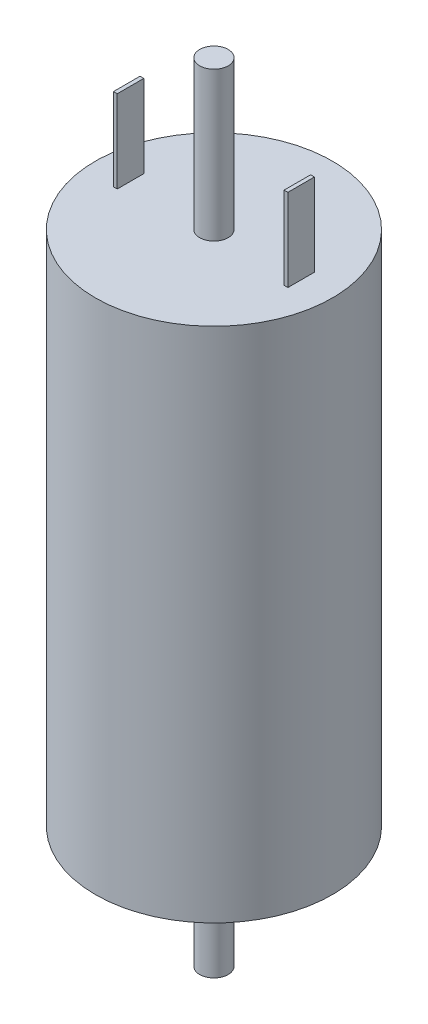
from build123d import *

# Parameters (mm, degrees)
SKETCH1_R           = 12.5
BOSS_EXTRUDE1_DEPTH = 54.5
SKETCH2_R           = 1.5
BOSS_EXTRUDE2_DEPTH = 12.8
BOSS_EXTRUDE3_START = 15.7
SKETCH3_R           = 1.5
BOSS_EXTRUDE3_DEPTH = 15.7
SKETCH4_W           = 0.4
SKETCH4_H           = 2.8
BOSS_EXTRUDE4_DEPTH = 8.7
SKETCH5_R           = 1
CUT_EXTRUDE1_DEPTH  = 2.9
SKETCH6_R           = 5
BOSS_EXTRUDE5_DEPTH = 2.9


with BuildPart() as part:
    # Sketch1 → Boss-Extrude1 (new body)
    with BuildSketch(Plane(origin=(0, 0, 0), x_dir=(1, 0, 0), z_dir=(0, 1, 0))):
        with Locations(Location((0, 0, 0), (0, 0, 270))):
            Circle(SKETCH1_R)
    extrude(amount=-BOSS_EXTRUDE1_DEPTH)

    # Sketch2 → Boss-Extrude2 (add)
    with BuildSketch(Plane.XZ.offset(54.5)):
        with Locations(Location((0, 0, 0), (0, 0, 90))):
            Circle(SKETCH2_R)
    extrude(amount=BOSS_EXTRUDE2_DEPTH)

    # Sketch3 → Boss-Extrude3 (add)
    with BuildSketch(Plane(origin=(0, 0, 0), x_dir=(1, 0, 0), z_dir=(0, 1, 0)).offset(BOSS_EXTRUDE3_START)):
        with Locations(Location((0, 0, 0), (0, 0, 270))):
            Circle(SKETCH3_R)
    extrude(amount=-BOSS_EXTRUDE3_DEPTH)

    # Sketch4 → Boss-Extrude4 (add)
    with BuildSketch(Plane(origin=(0, 0, 0), x_dir=(1, 0, 0), z_dir=(0, 1, 0))):
        with Locations((9, 0)):
            Rectangle(SKETCH4_W, SKETCH4_H)
        with Locations((-9, 0)):
            Rectangle(SKETCH4_W, SKETCH4_H)
    extrude(amount=BOSS_EXTRUDE4_DEPTH)

    # Sketch5 → Cut-Extrude1 (cut)
    with BuildSketch(Plane.XZ.offset(54.5)):
        with Locations(Location((0, 8.5, 0), (0, 0, 270))):
            Circle(SKETCH5_R)
        with Locations(Location((0, -8.5, 0), (0, 0, 270))):
            Circle(SKETCH5_R)
        with Locations(Location((-7.361215932, -4.25, 0), (0, 0, 270))):
            Circle(SKETCH5_R)
        with Locations(Location((7.361215932, -4.25, 0), (0, 0, 90))):
            Circle(SKETCH5_R)
    extrude(amount=-CUT_EXTRUDE1_DEPTH, mode=Mode.SUBTRACT)

    # Sketch6 → Boss-Extrude5 (add)
    with BuildSketch(Plane.XZ.offset(54.5)):
        with Locations(Location((0, 0, 0), (0, 0, 90))):
            Circle(SKETCH6_R)
    extrude(amount=BOSS_EXTRUDE5_DEPTH)


solid = part.part
